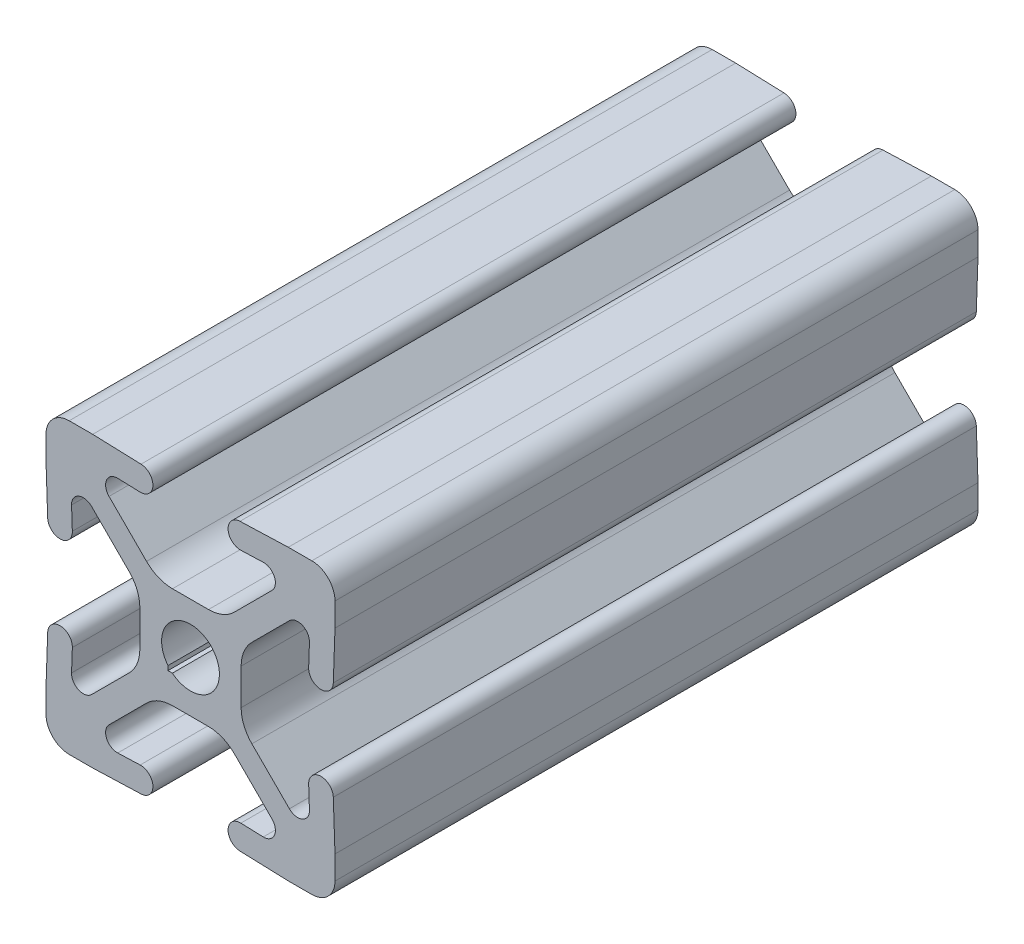
from build123d import *

# Parameters (mm, degrees)
BOSS_EXTRUDE1_DEPTH = 55.626


with BuildPart() as part:
    # Model → Boss-Extrude1 (new body)
    with BuildSketch(Plane.XY):
        with BuildLine():
            Line((50.659960212, 72.999871414), (53.774553856, 72.999871414))
            ThreePointArc((53.774553856, 72.999871414), (54.989573754, 72.758188929), (56.019617887, 72.069935444))
            Line((56.019617887, 72.069935444), (59.264200891, 68.825352439))
            ThreePointArc((59.264200891, 68.825352439), (59.477513437, 67.701802895), (58.510322513, 67.091550869))
            Line((58.510322513, 67.091550869), (56.572487817, 67.159221548))
            ThreePointArc((56.572487817, 67.159221548), (55.4691069, 66.130302197), (56.498026251, 65.026921279))
            Line((56.498026251, 65.026921279), (60.677257034, 64.880979325))
            Line((60.677257034, 64.880979325), (62.710657034, 64.880979325))
            ThreePointArc((62.710657034, 64.880979325), (64.129537501, 65.468698857), (64.717257034, 66.887579325))
            Line((64.717257034, 66.887579325), (64.717257034, 68.920979325))
            Line((64.717257034, 68.920979325), (64.57131508, 73.100210108))
            ThreePointArc((64.57131508, 73.100210108), (63.467934162, 74.129129459), (62.439014811, 73.025748542))
            Line((62.439014811, 73.025748542), (62.50668549, 71.087913846))
            ThreePointArc((62.50668549, 71.087913846), (61.896433464, 70.120722922), (60.77288392, 70.334035468))
            Line((60.77288392, 70.334035468), (57.528300915, 73.578618472))
            ThreePointArc((57.528300915, 73.578618472), (56.84004743, 74.608662605), (56.598364945, 75.823682503))
            Line((56.598364945, 75.823682503), (56.598364945, 78.938276147))
            ThreePointArc((56.598364945, 78.938276147), (56.84004743, 80.153296044), (57.528300915, 81.183340177))
            Line((57.528300915, 81.183340177), (60.77288392, 84.427923182))
            ThreePointArc((60.77288392, 84.427923182), (61.896433464, 84.641235728), (62.50668549, 83.674044803))
            Line((62.50668549, 83.674044803), (62.439014811, 81.736210108))
            ThreePointArc((62.439014811, 81.736210108), (63.467934162, 80.63282919), (64.57131508, 81.661748542))
            Line((64.57131508, 81.661748542), (64.717257034, 85.840979325))
            Line((64.717257034, 85.840979325), (64.717257034, 87.874379325))
            ThreePointArc((64.717257034, 87.874379325), (64.129537501, 89.293259792), (62.710657034, 89.880979325))
            Line((62.710657034, 89.880979325), (60.677257034, 89.880979325))
            Line((60.677257034, 89.880979325), (56.498026251, 89.73503737))
            ThreePointArc((56.498026251, 89.73503737), (55.4691069, 88.631656452), (56.572487817, 87.602737101))
            Line((56.572487817, 87.602737101), (58.510322513, 87.67040778))
            ThreePointArc((58.510322513, 87.67040778), (59.477513437, 87.060155754), (59.264200891, 85.93660621))
            Line((59.264200891, 85.93660621), (56.019617887, 82.692023205))
            ThreePointArc((56.019617887, 82.692023205), (54.989573754, 82.00376972), (53.774553856, 81.762087236))
            Line((53.774553856, 81.762087236), (50.659960212, 81.762087236))
            ThreePointArc((50.659960212, 81.762087236), (49.444940315, 82.00376972), (48.414896182, 82.692023205))
            Line((48.414896182, 82.692023205), (45.170313177, 85.93660621))
            ThreePointArc((45.170313177, 85.93660621), (44.957000631, 87.060155754), (45.924191556, 87.67040778))
            Line((45.924191556, 87.67040778), (47.862026251, 87.602737101))
            ThreePointArc((47.862026251, 87.602737101), (48.965407169, 88.631656452), (47.936487817, 89.73503737))
            Line((47.936487817, 89.73503737), (43.757257034, 89.880979325))
            Line((43.757257034, 89.880979325), (41.723857034, 89.880979325))
            ThreePointArc((41.723857034, 89.880979325), (40.304976567, 89.293259792), (39.717257034, 87.874379325))
            Line((39.717257034, 87.874379325), (39.717257034, 85.840979325))
            Line((39.717257034, 85.840979325), (39.863198989, 81.661748542))
            ThreePointArc((39.863198989, 81.661748542), (40.966579907, 80.63282919), (41.995499258, 81.736210108))
            Line((41.995499258, 81.736210108), (41.927828579, 83.674044803))
            ThreePointArc((41.927828579, 83.674044803), (42.538080605, 84.641235728), (43.661630149, 84.427923182))
            Line((43.661630149, 84.427923182), (46.906213154, 81.183340177))
            ThreePointArc((46.906213154, 81.183340177), (47.594466639, 80.153296044), (47.836149123, 78.938276147))
            Line((47.836149123, 78.938276147), (47.836149123, 75.823682503))
            ThreePointArc((47.836149123, 75.823682503), (47.594466639, 74.608662605), (46.906213154, 73.578618472))
            Line((46.906213154, 73.578618472), (43.661630149, 70.334035468))
            ThreePointArc((43.661630149, 70.334035468), (42.538080605, 70.120722922), (41.927828579, 71.087913846))
            Line((41.927828579, 71.087913846), (41.995499258, 73.025748542))
            ThreePointArc((41.995499258, 73.025748542), (40.966579907, 74.129129459), (39.863198989, 73.100210108))
            Line((39.863198989, 73.100210108), (39.717257034, 68.920979325))
            Line((39.717257034, 68.920979325), (39.717257034, 66.887579325))
            ThreePointArc((39.717257034, 66.887579325), (40.304976567, 65.468698857), (41.723857034, 64.880979325))
            Line((41.723857034, 64.880979325), (43.757257034, 64.880979325))
            Line((43.757257034, 64.880979325), (47.936487817, 65.026921279))
            ThreePointArc((47.936487817, 65.026921279), (48.965407169, 66.130302197), (47.862026251, 67.159221548))
            Line((47.862026251, 67.159221548), (45.924191556, 67.091550869))
            ThreePointArc((45.924191556, 67.091550869), (44.957000631, 67.701802895), (45.170313177, 68.825352439))
            Line((45.170313177, 68.825352439), (48.414896182, 72.069935444))
            ThreePointArc((48.414896182, 72.069935444), (49.444940315, 72.758188929), (50.659960212, 72.999871414))
        make_face()
        with BuildLine():
            Line((50.64953831, 75.433607249), (50.269884959, 75.433607249))
            Line((50.269884959, 75.433607249), (50.269884959, 75.8132606))
            ThreePointArc((50.269884959, 75.8132606), (53.985023987, 79.148746278), (50.64953831, 75.433607249))
        make_face(mode=Mode.SUBTRACT)
    extrude(amount=BOSS_EXTRUDE1_DEPTH)


solid = part.part
